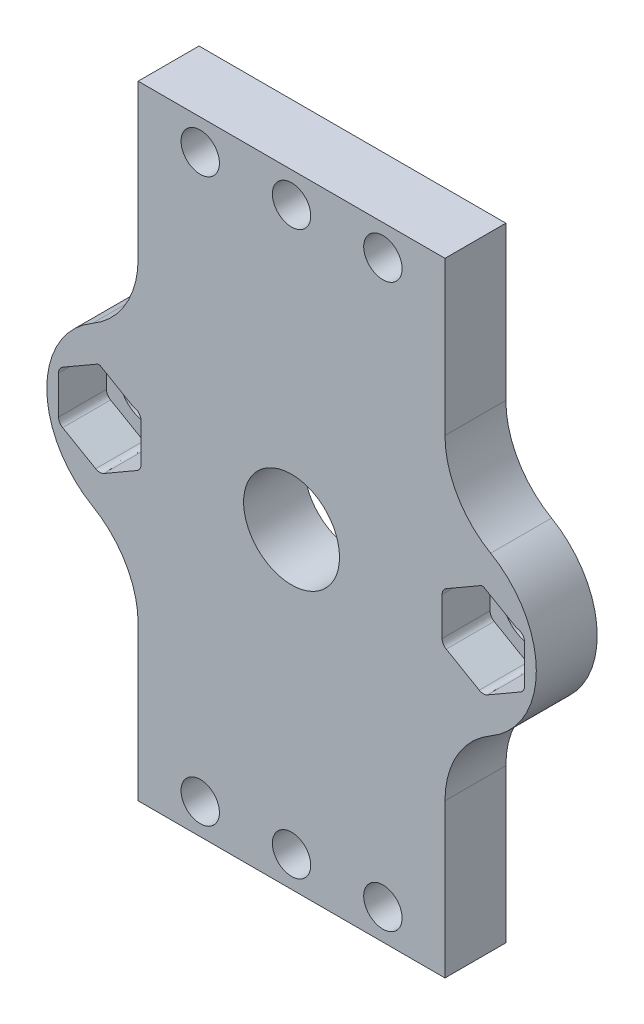
from build123d import *

# Parameters (mm, degrees)
SKETCH1_R           = 2
SKETCH1_R_2         = 3
SKETCH1_R_3         = 5
BOSS_EXTRUDE1_DEPTH = 6.35
CUT_EXTRUDE1_DEPTH  = 5


with BuildPart() as part:
    # Sketch1 → Boss-Extrude1 (new body)
    with BuildSketch(Plane.XY):
        with BuildLine():
            Line((-33.721219758, 79.523391471), (-33.721219758, 63.521175413))
            ThreePointArc((-33.721219758, 63.521175413), (-34.997327787, 58.758675413), (-38.483719758, 55.272283442))
            ThreePointArc((-38.483719758, 55.272283442), (-43.246219758, 47.023391471), (-38.483719758, 38.7744995))
            ThreePointArc((-38.483719758, 38.7744995), (-34.997327787, 35.288107529), (-33.721219758, 30.525607529))
            Line((-33.721219758, 30.525607529), (-33.721219758, 14.523391471))
            Line((-33.721219758, 14.523391471), (-1.721219758, 14.523391471))
            Line((-1.721219758, 14.523391471), (-1.721219758, 30.525607529))
            ThreePointArc((-1.721219758, 30.525607529), (-0.445111729, 35.288107529), (3.041280242, 38.7744995))
            ThreePointArc((3.041280242, 38.7744995), (7.803780242, 47.023391471), (3.041280242, 55.272283442))
            ThreePointArc((3.041280242, 55.272283442), (-0.445111729, 58.758675413), (-1.721219758, 63.521175413))
            Line((-1.721219758, 63.521175413), (-1.721219758, 79.523391471))
            Line((-1.721219758, 79.523391471), (-33.721219758, 79.523391471))
        make_face()
        with Locations((-27.246219758, 17.698391471)):
            Circle(SKETCH1_R, mode=Mode.SUBTRACT)
        with Locations((-17.721219758, 17.698391471)):
            Circle(SKETCH1_R, mode=Mode.SUBTRACT)
        with Locations((-8.196219758, 17.698391471)):
            Circle(SKETCH1_R, mode=Mode.SUBTRACT)
        with Locations((2.278780242, 47.023391471)):
            Circle(SKETCH1_R_2, mode=Mode.SUBTRACT)
        with Locations((-17.721219758, 47.023391471)):
            Circle(SKETCH1_R_3, mode=Mode.SUBTRACT)
        with Locations((-37.721219758, 47.023391471)):
            Circle(SKETCH1_R_2, mode=Mode.SUBTRACT)
        with Locations((-8.196219758, 76.348391471)):
            Circle(SKETCH1_R, mode=Mode.SUBTRACT)
        with Locations((-17.721219758, 76.348391471)):
            Circle(SKETCH1_R, mode=Mode.SUBTRACT)
        with Locations((-27.246219758, 76.348391471)):
            Circle(SKETCH1_R, mode=Mode.SUBTRACT)
    extrude(amount=BOSS_EXTRUDE1_DEPTH)

    # Sketch4 → Cut-Extrude1 (cut)
    with BuildSketch(Plane.XY.offset(6.35)):
        with BuildLine():
            Line((-41.59152192, 49.754083791), (-38.150917595, 51.740517624))
            add(Edge.make_bspline(
                [(-38.150917595, 51.740517624), (-38.150869583, 51.740562969), (-38.150821571, 51.740608313), (-38.150773559, 51.740653658), (-38.140760356, 51.750110547), (-38.130049943, 51.759483988), (-38.118551254, 51.768611863), (-38.061864566, 51.813610818), (-37.997677712, 51.844478449), (-37.860134339, 51.877491118), (-37.78892963, 51.879119687), (-37.717994015, 51.86475218), (-37.703604984, 51.861837784), (-37.689806894, 51.858346787), (-37.676592185, 51.854464977), (-37.676528822, 51.854446365), (-37.676465459, 51.854427752), (-37.676402096, 51.854409139)],
                knots=[-0.29360105, -0.29360105, -0.29360105, -0.29360105, -0.293566721, -0.293566721, -0.293566721, -0.288728131, -0.288728131, -0.288728131, -0.264901782, -0.264901782, -0.241075433, -0.241075433, -0.241075433, -0.236236844, -0.236236844, -0.236236844, -0.236202514, -0.236202514, -0.236202514, -0.236202514], degree=3, weights=[1, 1, 1, 1, 1, 1, 1, 1, 1, 1, 1, 1, 1, 1, 1, 1, 1, 1]))
            Line((-37.676402096, 51.854409139), (-34.236352722, 49.868295707))
            ThreePointArc((-34.236352722, 49.868295707), (-33.961845326, 49.807616487), (-33.721219758, 49.662235561))
            add(Edge.make_bspline(
                [(-33.721219758, 49.662235561), (-33.646868003, 49.598570147), (-33.58498248, 49.523558059), (-33.474161663, 49.331610773), (-33.435789847, 49.212193934), (-33.42456257, 49.085229038), (-33.422285158, 49.05947467), (-33.421276989, 49.034429669), (-33.421220569, 49.010174212), (-33.421220299, 49.01005791), (-33.421220028, 49.009941608), (-33.421219758, 49.009825305)],
                knots=[-0.283474511, -0.283474511, -0.283474511, -0.283474511, -0.264901782, -0.264901782, -0.241075433, -0.241075433, -0.241075433, -0.236236844, -0.236236844, -0.236236844, -0.236202514, -0.236202514, -0.236202514, -0.236202514], degree=3, weights=[1, 1, 1, 1, 1, 1, 1, 1, 1, 1, 1, 1]))
            Line((-33.421219758, 49.009825305), (-33.421219758, 45.036957637))
            add(Edge.make_bspline(
                [(-33.421219758, 45.036957637), (-33.421220028, 45.036841335), (-33.421220299, 45.036725033), (-33.421220569, 45.036608731), (-33.421276989, 45.012353275), (-33.422285158, 44.987308273), (-33.42456257, 44.961553905), (-33.435789847, 44.834589009), (-33.474161663, 44.715172171), (-33.58498248, 44.523224884), (-33.646868003, 44.448212797), (-33.721219758, 44.384547382)],
                knots=[-0.29360105, -0.29360105, -0.29360105, -0.29360105, -0.293566721, -0.293566721, -0.293566721, -0.288728131, -0.288728131, -0.288728131, -0.264901782, -0.264901782, -0.246329054, -0.246329054, -0.246329054, -0.246329054], degree=3, weights=[1, 1, 1, 1, 1, 1, 1, 1, 1, 1, 1, 1]))
            add(Edge.make_bspline(
                [(-33.721219758, 44.384547382), (-33.74225145, 44.366538508), (-33.764280614, 44.349437527), (-33.787287454, 44.333295977), (-33.808452684, 44.318446497), (-33.829638208, 44.305050896), (-33.850615839, 44.292874307), (-33.850716425, 44.292815922), (-33.85081701, 44.292757536), (-33.850917596, 44.292699151)],
                knots=[-0.246329054, -0.246329054, -0.246329054, -0.246329054, -0.241075433, -0.241075433, -0.241075433, -0.236236844, -0.236236844, -0.236236844, -0.236202514, -0.236202514, -0.236202514, -0.236202514], degree=3, weights=[1, 1, 1, 1, 1, 1, 1, 1, 1, 1]))
            Line((-33.850917596, 44.292699151), (-37.291521921, 42.306265318))
            add(Edge.make_bspline(
                [(-37.291521921, 42.306265318), (-37.291622777, 42.306207401), (-37.291723632, 42.306149484), (-37.291824488, 42.306091567), (-37.312858539, 42.2940127), (-37.335052231, 42.282363299), (-37.358494874, 42.271458412), (-37.474063338, 42.217699071), (-37.596667262, 42.191221619), (-37.845772254, 42.191221619), (-37.968376177, 42.217699071), (-38.083944642, 42.271458412), (-38.107387285, 42.282363299), (-38.129580977, 42.2940127), (-38.150615028, 42.306091567), (-38.150715884, 42.306149484), (-38.15081674, 42.306207401), (-38.150917596, 42.306265318)],
                knots=[-0.29360105, -0.29360105, -0.29360105, -0.29360105, -0.293566721, -0.293566721, -0.293566721, -0.288728131, -0.288728131, -0.288728131, -0.264901782, -0.264901782, -0.241075433, -0.241075433, -0.241075433, -0.236236844, -0.236236844, -0.236236844, -0.236202514, -0.236202514, -0.236202514, -0.236202514], degree=3, weights=[1, 1, 1, 1, 1, 1, 1, 1, 1, 1, 1, 1, 1, 1, 1, 1, 1, 1]))
            Line((-38.150917596, 42.306265318), (-41.591521921, 44.292699151))
            add(Edge.make_bspline(
                [(-41.591521921, 44.292699151), (-41.591622506, 44.292757537), (-41.591723091, 44.292815922), (-41.591823677, 44.292874307), (-41.612801308, 44.305050896), (-41.633986832, 44.318446497), (-41.655152062, 44.333295977), (-41.759493249, 44.406501533), (-41.843725357, 44.499440919), (-41.968277853, 44.715172171), (-42.006649668, 44.834589009), (-42.017876946, 44.961553905), (-42.020154358, 44.987308273), (-42.021162527, 45.012353275), (-42.021218946, 45.036608731), (-42.021219217, 45.036725033), (-42.021219487, 45.036841336), (-42.021219758, 45.036957638)],
                knots=[-0.29360105, -0.29360105, -0.29360105, -0.29360105, -0.293566721, -0.293566721, -0.293566721, -0.288728131, -0.288728131, -0.288728131, -0.264901782, -0.264901782, -0.241075433, -0.241075433, -0.241075433, -0.236236844, -0.236236844, -0.236236844, -0.236202514, -0.236202514, -0.236202514, -0.236202514], degree=3, weights=[1, 1, 1, 1, 1, 1, 1, 1, 1, 1, 1, 1, 1, 1, 1, 1, 1, 1]))
            Line((-42.021219758, 45.036957638), (-42.021219758, 49.009825305))
            add(Edge.make_bspline(
                [(-42.021219758, 49.009825305), (-42.021219487, 49.009941607), (-42.021219217, 49.010057909), (-42.021218946, 49.01017421), (-42.021162527, 49.034429667), (-42.020154358, 49.059474669), (-42.017876946, 49.085229036), (-42.006649668, 49.212193932), (-41.968277853, 49.331610771), (-41.843725357, 49.547342023), (-41.759493249, 49.640281408), (-41.655152062, 49.713486964), (-41.633986832, 49.728336445), (-41.612801308, 49.741732045), (-41.591823677, 49.753908634), (-41.591723091, 49.75396702), (-41.591622506, 49.754025405), (-41.59152192, 49.754083791)],
                knots=[-0.29360105, -0.29360105, -0.29360105, -0.29360105, -0.293566721, -0.293566721, -0.293566721, -0.288728131, -0.288728131, -0.288728131, -0.264901782, -0.264901782, -0.241075433, -0.241075433, -0.241075433, -0.236236844, -0.236236844, -0.236236844, -0.236202514, -0.236202514, -0.236202514, -0.236202514], degree=3, weights=[1, 1, 1, 1, 1, 1, 1, 1, 1, 1, 1, 1, 1, 1, 1, 1, 1, 1]))
        make_face()
        with BuildLine():
            Line((-1.59152192, 49.754083791), (1.849082405, 51.740517624))
            add(Edge.make_bspline(
                [(1.849082405, 51.740517624), (1.849130417, 51.740562969), (1.849178429, 51.740608313), (1.849226441, 51.740653658), (1.859239644, 51.750110547), (1.869950057, 51.759483988), (1.881448746, 51.768611863), (1.938135434, 51.813610818), (2.002322288, 51.844478449), (2.139865661, 51.877491118), (2.21107037, 51.879119687), (2.282005985, 51.86475218), (2.296395016, 51.861837784), (2.310193106, 51.858346787), (2.323407815, 51.854464977), (2.323471178, 51.854446365), (2.323534541, 51.854427752), (2.323597904, 51.854409139)],
                knots=[-0.29360105, -0.29360105, -0.29360105, -0.29360105, -0.293566721, -0.293566721, -0.293566721, -0.288728131, -0.288728131, -0.288728131, -0.264901782, -0.264901782, -0.241075433, -0.241075433, -0.241075433, -0.236236844, -0.236236844, -0.236236844, -0.236202514, -0.236202514, -0.236202514, -0.236202514], degree=3, weights=[1, 1, 1, 1, 1, 1, 1, 1, 1, 1, 1, 1, 1, 1, 1, 1, 1, 1]))
            Line((2.323597904, 51.854409139), (5.763647278, 49.868295707))
            ThreePointArc((5.763647278, 49.868295707), (6.038154674, 49.807616487), (6.278780242, 49.662235561))
            add(Edge.make_bspline(
                [(6.278780242, 49.662235561), (6.353131997, 49.598570147), (6.41501752, 49.523558059), (6.525838337, 49.331610773), (6.564210153, 49.212193934), (6.57543743, 49.085229038), (6.577714842, 49.05947467), (6.578723011, 49.034429669), (6.578779431, 49.010174212), (6.578779701, 49.01005791), (6.578779972, 49.009941608), (6.578780242, 49.009825305)],
                knots=[-0.283474511, -0.283474511, -0.283474511, -0.283474511, -0.264901782, -0.264901782, -0.241075433, -0.241075433, -0.241075433, -0.236236844, -0.236236844, -0.236236844, -0.236202514, -0.236202514, -0.236202514, -0.236202514], degree=3, weights=[1, 1, 1, 1, 1, 1, 1, 1, 1, 1, 1, 1]))
            Line((6.578780242, 49.009825305), (6.578780242, 45.036957637))
            add(Edge.make_bspline(
                [(6.578780242, 45.036957637), (6.578779972, 45.036841335), (6.578779701, 45.036725033), (6.578779431, 45.036608731), (6.578723011, 45.012353275), (6.577714842, 44.987308273), (6.57543743, 44.961553905), (6.564210153, 44.834589009), (6.525838337, 44.715172171), (6.41501752, 44.523224884), (6.353131997, 44.448212797), (6.278780242, 44.384547382)],
                knots=[-0.29360105, -0.29360105, -0.29360105, -0.29360105, -0.293566721, -0.293566721, -0.293566721, -0.288728131, -0.288728131, -0.288728131, -0.264901782, -0.264901782, -0.246329054, -0.246329054, -0.246329054, -0.246329054], degree=3, weights=[1, 1, 1, 1, 1, 1, 1, 1, 1, 1, 1, 1]))
            add(Edge.make_bspline(
                [(6.278780242, 44.384547382), (6.25774855, 44.366538508), (6.235719386, 44.349437527), (6.212712546, 44.333295977), (6.191547316, 44.318446497), (6.170361792, 44.305050896), (6.149384161, 44.292874307), (6.149283575, 44.292815922), (6.14918299, 44.292757536), (6.149082404, 44.292699151)],
                knots=[-0.246329054, -0.246329054, -0.246329054, -0.246329054, -0.241075433, -0.241075433, -0.241075433, -0.236236844, -0.236236844, -0.236236844, -0.236202514, -0.236202514, -0.236202514, -0.236202514], degree=3, weights=[1, 1, 1, 1, 1, 1, 1, 1, 1, 1]))
            Line((6.149082404, 44.292699151), (2.708478079, 42.306265318))
            add(Edge.make_bspline(
                [(2.708478079, 42.306265318), (2.708377223, 42.306207401), (2.708276368, 42.306149484), (2.708175512, 42.306091567), (2.687141461, 42.2940127), (2.664947769, 42.282363299), (2.641505126, 42.271458412), (2.525936662, 42.217699071), (2.403332738, 42.191221619), (2.154227746, 42.191221619), (2.031623823, 42.217699071), (1.916055358, 42.271458412), (1.892612715, 42.282363299), (1.870419023, 42.2940127), (1.849384972, 42.306091567), (1.849284116, 42.306149484), (1.84918326, 42.306207401), (1.849082404, 42.306265318)],
                knots=[-0.29360105, -0.29360105, -0.29360105, -0.29360105, -0.293566721, -0.293566721, -0.293566721, -0.288728131, -0.288728131, -0.288728131, -0.264901782, -0.264901782, -0.241075433, -0.241075433, -0.241075433, -0.236236844, -0.236236844, -0.236236844, -0.236202514, -0.236202514, -0.236202514, -0.236202514], degree=3, weights=[1, 1, 1, 1, 1, 1, 1, 1, 1, 1, 1, 1, 1, 1, 1, 1, 1, 1]))
            Line((1.849082404, 42.306265318), (-1.591521921, 44.292699151))
            add(Edge.make_bspline(
                [(-1.591521921, 44.292699151), (-1.591622506, 44.292757537), (-1.591723091, 44.292815922), (-1.591823677, 44.292874307), (-1.612801308, 44.305050896), (-1.633986832, 44.318446497), (-1.655152062, 44.333295977), (-1.759493249, 44.406501533), (-1.843725357, 44.499440919), (-1.968277853, 44.715172171), (-2.006649668, 44.834589009), (-2.017876946, 44.961553905), (-2.020154358, 44.987308273), (-2.021162527, 45.012353275), (-2.021218946, 45.036608731), (-2.021219217, 45.036725033), (-2.021219487, 45.036841336), (-2.021219758, 45.036957638)],
                knots=[-0.29360105, -0.29360105, -0.29360105, -0.29360105, -0.293566721, -0.293566721, -0.293566721, -0.288728131, -0.288728131, -0.288728131, -0.264901782, -0.264901782, -0.241075433, -0.241075433, -0.241075433, -0.236236844, -0.236236844, -0.236236844, -0.236202514, -0.236202514, -0.236202514, -0.236202514], degree=3, weights=[1, 1, 1, 1, 1, 1, 1, 1, 1, 1, 1, 1, 1, 1, 1, 1, 1, 1]))
            Line((-2.021219758, 45.036957638), (-2.021219758, 49.009825305))
            add(Edge.make_bspline(
                [(-2.021219758, 49.009825305), (-2.021219487, 49.009941607), (-2.021219217, 49.010057909), (-2.021218946, 49.01017421), (-2.021162527, 49.034429667), (-2.020154358, 49.059474669), (-2.017876946, 49.085229036), (-2.006649668, 49.212193932), (-1.968277853, 49.331610771), (-1.843725357, 49.547342023), (-1.759493249, 49.640281408), (-1.655152062, 49.713486964), (-1.633986832, 49.728336445), (-1.612801308, 49.741732045), (-1.591823677, 49.753908634), (-1.591723091, 49.75396702), (-1.591622506, 49.754025405), (-1.59152192, 49.754083791)],
                knots=[-0.29360105, -0.29360105, -0.29360105, -0.29360105, -0.293566721, -0.293566721, -0.293566721, -0.288728131, -0.288728131, -0.288728131, -0.264901782, -0.264901782, -0.241075433, -0.241075433, -0.241075433, -0.236236844, -0.236236844, -0.236236844, -0.236202514, -0.236202514, -0.236202514, -0.236202514], degree=3, weights=[1, 1, 1, 1, 1, 1, 1, 1, 1, 1, 1, 1, 1, 1, 1, 1, 1, 1]))
        make_face()
    extrude(amount=-CUT_EXTRUDE1_DEPTH, mode=Mode.SUBTRACT)


solid = part.part
